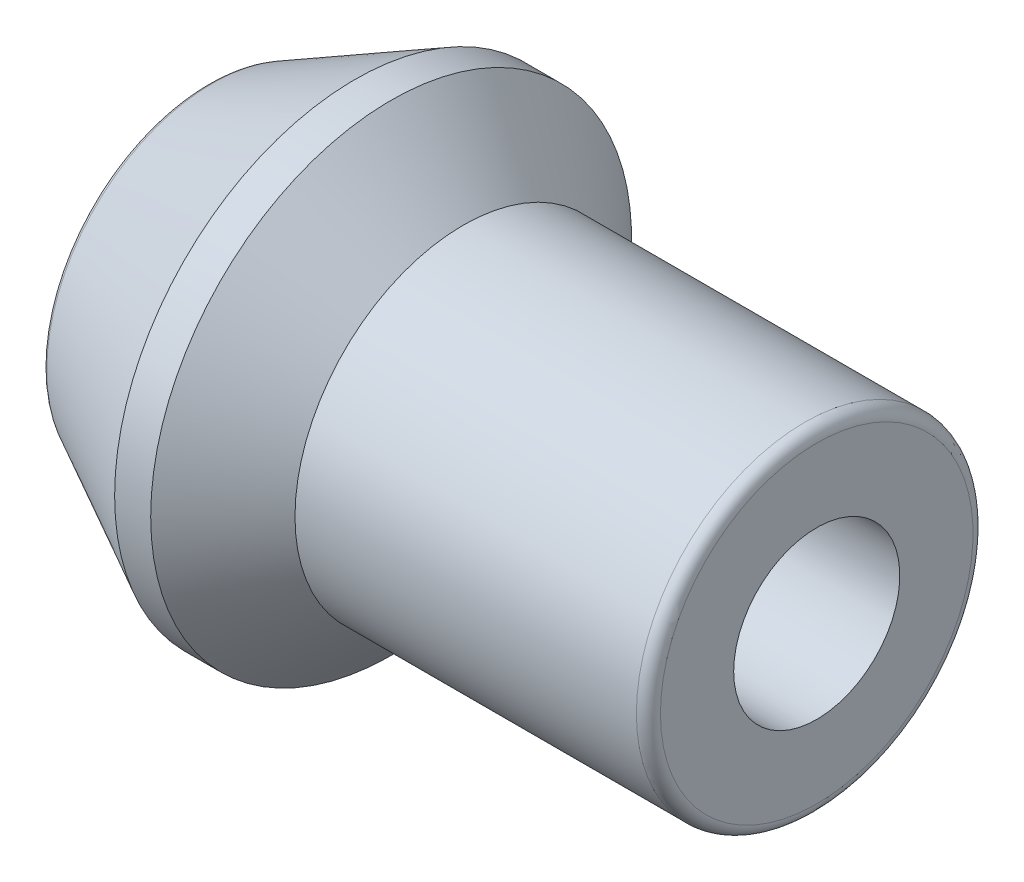
from build123d import *

# Parameters (mm, degrees)
TAP_DRILL_FOR_5_16_24_TAP1_D = 6.9088


with BuildPart() as part:
    # Sketch1 → Revolve1 (revolve)
    with BuildSketch(Plane.XY, mode=Mode.PRIVATE) as revolve1_sk:
        with BuildLine():
            Line((0, 0), (0, 6.447566244))
            ThreePointArc((0, 6.447566244), (0.072174996, 6.70634369), (0.267863065, 6.89041209))
            Line((0.267863065, 6.89041209), (6.2, 10))
            Line((6.2, 10), (7.7, 10))
            Line((7.7, 10), (10.7, 7))
            Line((10.7, 7), (24.9, 7))
            ThreePointArc((24.9, 7), (25.253553391, 6.853553391), (25.4, 6.5))
            Line((25.4, 6.5), (25.4, 0))
            Line((25.4, 0), (0, 0))
        make_face()
    revolve(revolve1_sk.sketch.rotate(Axis((-16.664675737, 0, 0), (1, 0, 0)), 90), axis=Axis((-16.664675737, 0, 0), (1, 0, 0)))

    # Tap Drill for 5/16-24 Tap1 (through all)
    with Locations(Plane.ZY):
        with Locations((0, 0)):
            Hole(TAP_DRILL_FOR_5_16_24_TAP1_D / 2)


solid = part.part
